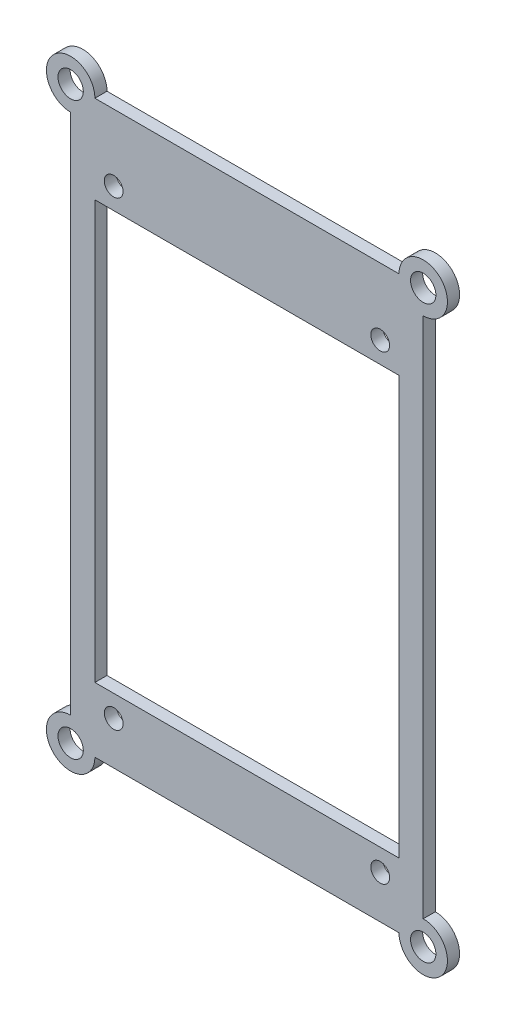
from build123d import *

# Parameters (mm, degrees)
SKETCH1_R           = 1.55
SKETCH1_R_2         = 1.552736715
SKETCH1_W           = 50.2
SKETCH1_H           = 69
BOSS_EXTRUDE1_DEPTH = 2
SKETCH2_R           = 2.09
CUT_EXTRUDE1_DEPTH  = 10


with BuildPart() as part:
    # Sketch1 → Boss-Extrude1 (new body)
    with BuildSketch(Plane.XY):
        with BuildLine():
            Line((54.323201224, 61.242975378), (4.123201224, 61.242975378))
            ThreePointArc((4.123201224, 61.242975378), (-2.705225901, 64.071402503), (0.123201224, 57.242975378))
            Line((0.123201224, 57.242975378), (0.123201224, -28.957024622))
            ThreePointArc((0.123201224, -28.957024622), (-2.705225901, -35.785451747), (4.123201224, -32.957024622))
            Line((4.123201224, -32.957024622), (54.323201224, -32.957024622))
            ThreePointArc((54.323201224, -32.957024622), (61.151628348, -35.785451747), (58.323201224, -28.957024622))
            Line((58.323201224, -28.957024622), (58.323201224, 57.242975378))
            ThreePointArc((58.323201224, 57.242975378), (61.151628348, 64.071402503), (54.323201224, 61.242975378))
        make_face()
        with Locations((7.223201224, 50.222695663)):
            Circle(SKETCH1_R, mode=Mode.SUBTRACT)
        with Locations((51.223201224, 50.222975378)):
            Circle(SKETCH1_R, mode=Mode.SUBTRACT)
        with Locations((7.233060223, -25.857304337)):
            Circle(SKETCH1_R_2, mode=Mode.SUBTRACT)
        with Locations((51.223201224, -25.857024622)):
            Circle(SKETCH1_R, mode=Mode.SUBTRACT)
        with Locations((29.223201224, 12.225914551)):
            Rectangle(SKETCH1_W, SKETCH1_H, mode=Mode.SUBTRACT)
    extrude(amount=BOSS_EXTRUDE1_DEPTH)

    # Sketch2 → Cut-Extrude1 (cut)
    with BuildSketch(Plane.XY.offset(2)):
        with Locations((0.123201224, 61.242975378)):
            Circle(SKETCH2_R)
        with Locations((58.323201224, 61.242975378)):
            Circle(SKETCH2_R)
        with Locations((0.123201224, -32.957024622)):
            Circle(SKETCH2_R)
        with Locations((58.323201224, -32.957024622)):
            Circle(SKETCH2_R)
    extrude(amount=-CUT_EXTRUDE1_DEPTH, mode=Mode.SUBTRACT)


solid = part.part
